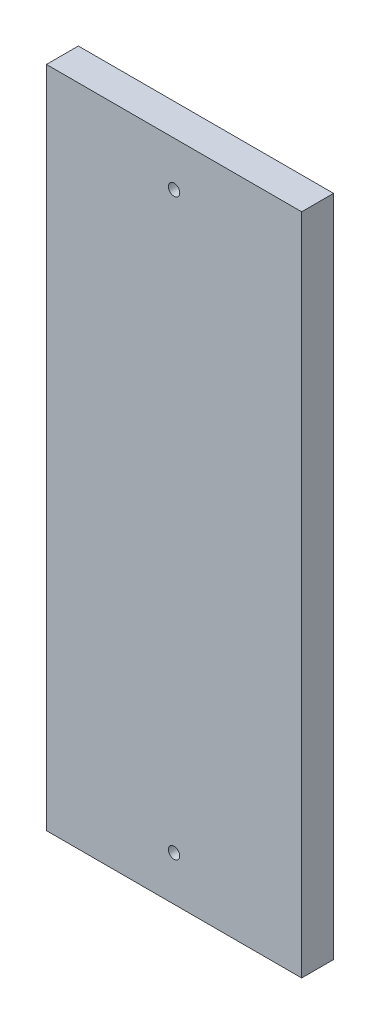
from build123d import *

# Parameters (mm, degrees)
SKETCH1_W           = 50.8
SKETCH1_H           = 6.35
BOSS_EXTRUDE1_DEPTH = 132.08
SKETCH2_R           = 1.1303
CUT_EXTRUDE1_DEPTH  = 135.649949499


with BuildPart() as part:
    # Sketch1 → Boss-Extrude1 (new body)
    with BuildSketch(Plane(origin=(0, 0, 0), x_dir=(1, 0, 0), z_dir=(0, 1, 0))):
        Rectangle(SKETCH1_W, SKETCH1_H)
    extrude(amount=BOSS_EXTRUDE1_DEPTH)

    # Sketch2 → Cut-Extrude1 (cut, through all)
    with BuildSketch(Plane.XY.offset(3.175)):
        with Locations((0, 123.19)):
            Circle(SKETCH2_R)
        with Locations(Location((0, 8.89, 0), (0, 0, 180))):
            Circle(SKETCH2_R)
    extrude(amount=-CUT_EXTRUDE1_DEPTH, mode=Mode.SUBTRACT)


solid = part.part
